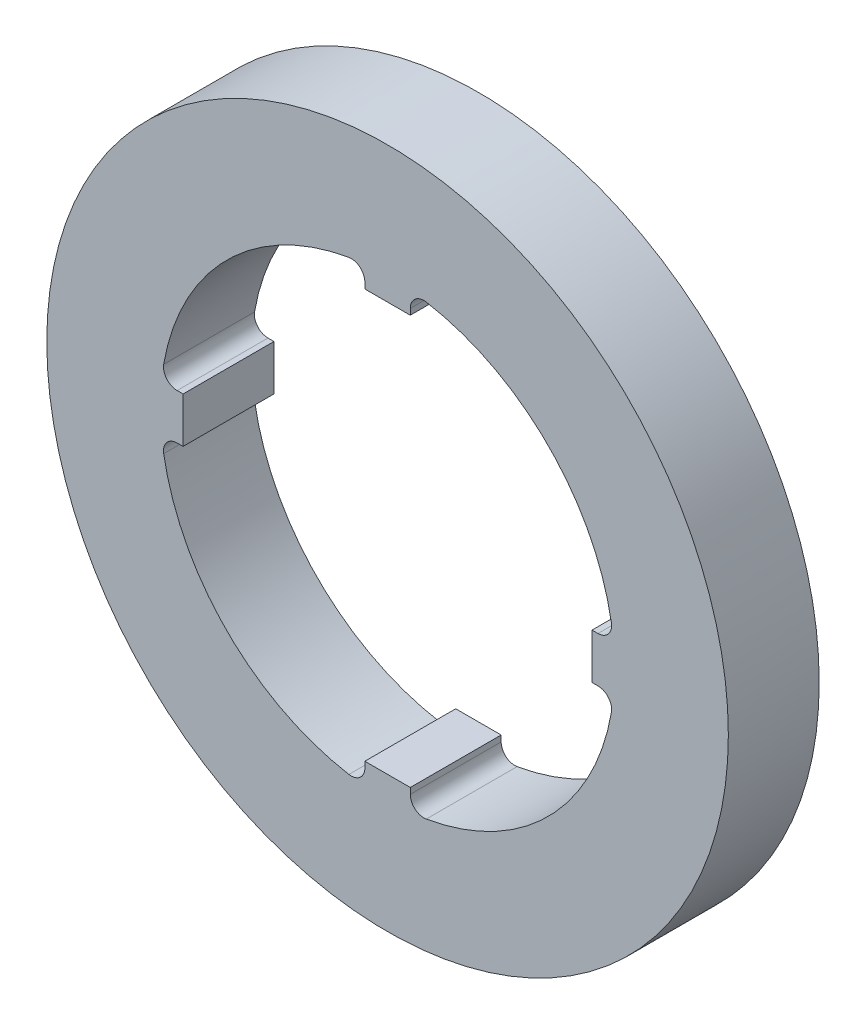
from build123d import *

# Parameters (mm, degrees)
SKETCH1_R           = 75
BOSS_EXTRUDE1_DEPTH = 10


with BuildPart() as part:
    # Sketch1 → Boss-Extrude1 (new, symmetric)
    with BuildSketch(Plane.XY):
        Circle(SKETCH1_R)
        with BuildLine():
            Line((-5, 46.314144708), (-5, 45))
            Line((-5, 45), (5, 45))
            Line((5, 45), (5, 46.314144708))
            ThreePointArc((5, 46.314144708), (6.067632914, 48.608912113), (8.510638298, 49.27036671))
            ThreePointArc((8.510638298, 49.27036671), (35.355339059, 35.355339059), (49.27036671, 8.510638298))
            ThreePointArc((49.27036671, 8.510638298), (48.608912113, 6.067632914), (46.314144708, 5))
            Line((46.314144708, 5), (45, 5))
            Line((45, 5), (45, -5))
            Line((45, -5), (46.314144708, -5))
            ThreePointArc((46.314144708, -5), (48.608912113, -6.067632914), (49.27036671, -8.510638298))
            ThreePointArc((49.27036671, -8.510638298), (35.355339059, -35.355339059), (8.510638298, -49.27036671))
            ThreePointArc((8.510638298, -49.27036671), (6.067632914, -48.608912113), (5, -46.314144708))
            Line((5, -46.314144708), (5, -45))
            Line((5, -45), (-5, -45))
            Line((-5, -45), (-5, -46.314144708))
            ThreePointArc((-5, -46.314144708), (-6.067632914, -48.608912113), (-8.510638298, -49.27036671))
            ThreePointArc((-8.510638298, -49.27036671), (-35.355339059, -35.355339059), (-49.27036671, -8.510638298))
            ThreePointArc((-49.27036671, -8.510638298), (-48.608912113, -6.067632914), (-46.314144708, -5))
            Line((-46.314144708, -5), (-45, -5))
            Line((-45, -5), (-45, 5))
            Line((-45, 5), (-46.314144708, 5))
            ThreePointArc((-46.314144708, 5), (-48.608912113, 6.067632914), (-49.27036671, 8.510638298))
            ThreePointArc((-49.27036671, 8.510638298), (-35.355339059, 35.355339059), (-8.510638298, 49.27036671))
            ThreePointArc((-8.510638298, 49.27036671), (-6.067632914, 48.608912113), (-5, 46.314144708))
        make_face(mode=Mode.SUBTRACT)
    extrude(amount=BOSS_EXTRUDE1_DEPTH, both=True)


solid = part.part
